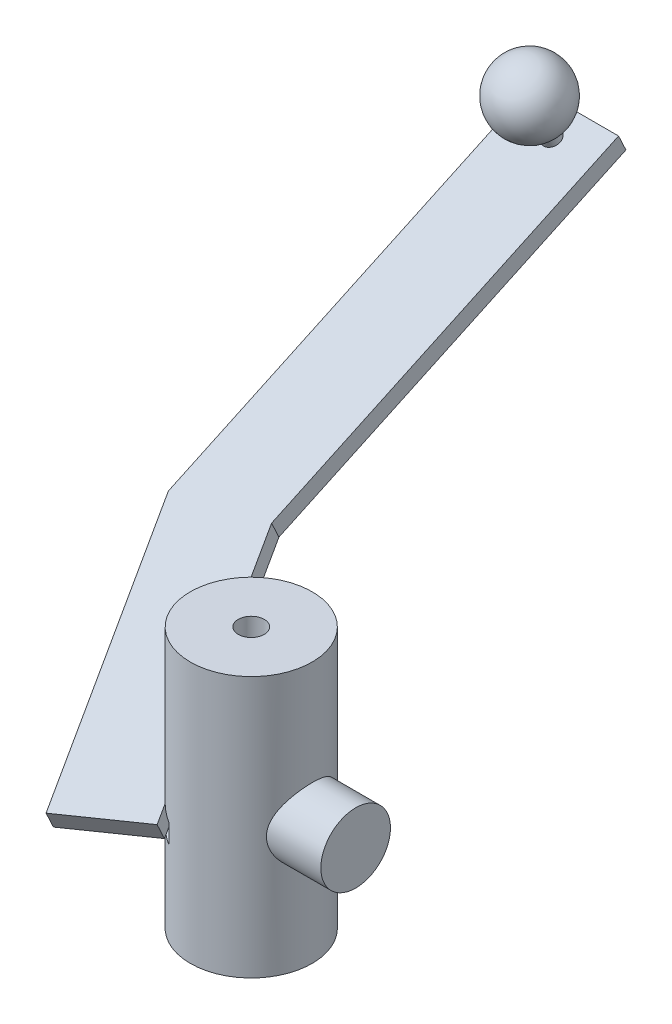
from build123d import *

# Parameters (mm, degrees)
SKETCH1_R           = 22.225
SKETCH1_R_2         = 4.7625
BOSS_EXTRUDE1_DEPTH = 95.25
SKETCH2_R           = 12.7
BOSS_EXTRUDE2_DEPTH = 38.1
BOSS_EXTRUDE3_START = -10.16
BOSS_EXTRUDE3_DEPTH = 101.6
CUT_EXTRUDE1_DEPTH  = 6.35
SKETCH5_R           = 3.175
BOSS_EXTRUDE4_DEPTH = 6.35
DOME1_FACE_RADIUS   = 3.175
DOME1_HEIGHT        = 25.4


with BuildPart() as part:
    # Sketch1 → Boss-Extrude1 (new body)
    with BuildSketch(Plane(origin=(0, 0, 0), x_dir=(1, 0, 0), z_dir=(0, 1, 0))):
        with Locations(Location((0, 0, 0), (0, 0, 270))):
            Circle(SKETCH1_R)
        with Locations(Location((0, 0, 0), (0, 0, 270))):
            Circle(SKETCH1_R_2, mode=Mode.SUBTRACT)
    extrude(amount=BOSS_EXTRUDE1_DEPTH)

    # Sketch2 → Boss-Extrude2 (add)
    with BuildSketch(Plane(origin=(0, 0, 0), x_dir=(0, 0, -1), z_dir=(1, 0, 0))):
        with Locations(Location((0, 44.45, 0), (0, 0, 180))):
            Circle(SKETCH2_R)
    extrude(amount=BOSS_EXTRUDE2_DEPTH)

    # Sketch3 → Boss-Extrude3 (add)
    with BuildSketch(Plane(origin=(0, 0, 0), x_dir=(0, 0, -1), z_dir=(1, 0, 0)).offset(BOSS_EXTRUDE3_START)):
        Polygon((-34.433625962, 31.155054448), (-31.75, 25.4), (186.942069012, 127.377786558), (184.25844305, 133.132841006), align=None)
    extrude(amount=-BOSS_EXTRUDE3_DEPTH)

    # Sketch4 → Cut-Extrude1 (cut)
    with BuildSketch(Plane(origin=(0, 38.779412625, 18.083137086), x_dir=(1, 0, 0), z_dir=(0, 0.9063077870366493, 0.42261826174070105))):
        with BuildLine():
            Line((-41.964599748, -16.344444393), (-81.980400092, 77.043433422))
            Line((-81.980400092, 77.043433422), (-81.980400092, 223.25923161))
            Line((-81.980400092, 223.25923161), (-111.76, 223.25923161))
            Line((-111.76, 223.25923161), (-111.76, -18.04076839))
            Line((-111.76, -18.04076839), (-10.16, -18.04076839))
            Line((-10.16, -18.04076839), (-10.16, -1.857678602))
            add(Edge.make_bspline(
                [(-15.398693032, 2.269861536), (-13.053103619, -0.216913648), (-10.16, -1.857678602)],
                knots=[5.477258717, 5.477258717, 5.477258717, 5.808405234, 5.808405234, 5.808405234], degree=2, weights=[0.860760797, 0.917991521, 1]))
            Line((-15.398693032, 2.269861536), (-12.78088793, -3.839506786))
            Line((-12.78088793, -3.839506786), (-41.964599748, -16.344444393))
        make_face()
        with BuildLine():
            Line((-10.16, 223.25923161), (-50.230400092, 223.25923161))
            Line((-50.230400092, 223.25923161), (-50.230400092, 83.55923161))
            Line((-50.230400092, 83.55923161), (-22.157554012, 18.043522888))
            add(Edge.make_bspline(
                [(-10.16, 41.762746934), (-23.308412463, 34.30589187), (-22.157554012, 18.043522888)],
                knots=[3.616372727, 3.616372727, 3.616372727, 4.782388845, 4.782388845, 4.782388845], degree=2, weights=[1, 0.711235953, 0.729678603]))
            Line((-10.16, 41.762746934), (-10.16, 223.25923161))
        make_face()
    extrude(amount=-CUT_EXTRUDE1_DEPTH, mode=Mode.SUBTRACT)

    # Sketch5 → Boss-Extrude4 (add)
    with BuildSketch(Plane(origin=(0, 38.779412625, 18.083137086), x_dir=(1, 0, 0), z_dir=(0, 0.906307787036649, 0.4226182617407014))):
        with Locations(Location((-66.105400092, 213.73423161, 0), (0, 0, 270))):
            Circle(SKETCH5_R)
    extrude(amount=BOSS_EXTRUDE4_DEPTH)

    # Dome1: a dome of height H over a round flat face of radius A is a cap of a sphere of radius (A * A + H * H) / (2 * H)
    dome1_r = (DOME1_FACE_RADIUS * DOME1_FACE_RADIUS + DOME1_HEIGHT * DOME1_HEIGHT) / (2 * DOME1_HEIGHT)
    dome1_base = Plane((-66.105400092, 134.86245651, -172.942235416), z_dir=(0, 0.906307787037, 0.422618261741))
    with Locations(dome1_base.offset(DOME1_HEIGHT - dome1_r)):
        dome1_ball = Sphere(dome1_r, mode=Mode.PRIVATE)
    add(split(dome1_ball, bisect_by=dome1_base, keep=Keep.TOP, mode=Mode.PRIVATE))


solid = part.part
